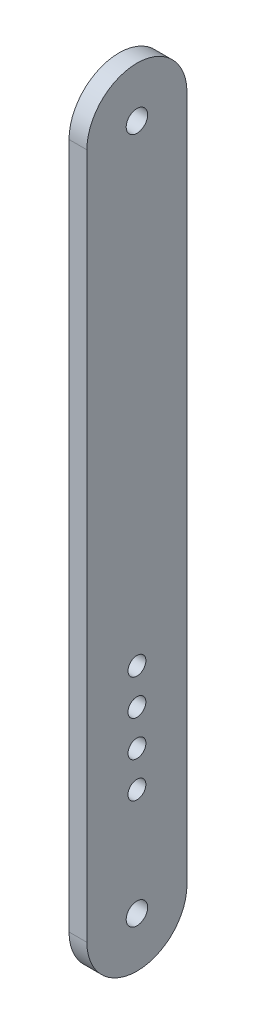
from build123d import *

# Parameters (mm, degrees)
SKETCH1_R           = 1.5
SKETCH1_R_2         = 1.25
BOSS_EXTRUDE1_DEPTH = 2.5


with BuildPart() as part:
    # Sketch1 → Boss-Extrude1 (new body)
    with BuildSketch(Plane(origin=(0, 0, 0), x_dir=(0, 0, -1), z_dir=(1, 0, 0))):
        with BuildLine():
            Line((-7, 0), (-7, 96))
            ThreePointArc((-7, 96), (0, 103), (7, 96))
            Line((7, 96), (7, 0))
            ThreePointArc((7, 0), (0, -7), (-7, 0))
        make_face()
        Circle(SKETCH1_R, mode=Mode.SUBTRACT)
        with Locations((0, 96)):
            Circle(SKETCH1_R, mode=Mode.SUBTRACT)
        with Locations((0, 15)):
            Circle(SKETCH1_R_2, mode=Mode.SUBTRACT)
        with Locations((0, 20)):
            Circle(SKETCH1_R_2, mode=Mode.SUBTRACT)
        with Locations((0, 25)):
            Circle(SKETCH1_R_2, mode=Mode.SUBTRACT)
        with Locations((0, 30)):
            Circle(SKETCH1_R_2, mode=Mode.SUBTRACT)
    extrude(amount=BOSS_EXTRUDE1_DEPTH)


solid = part.part
